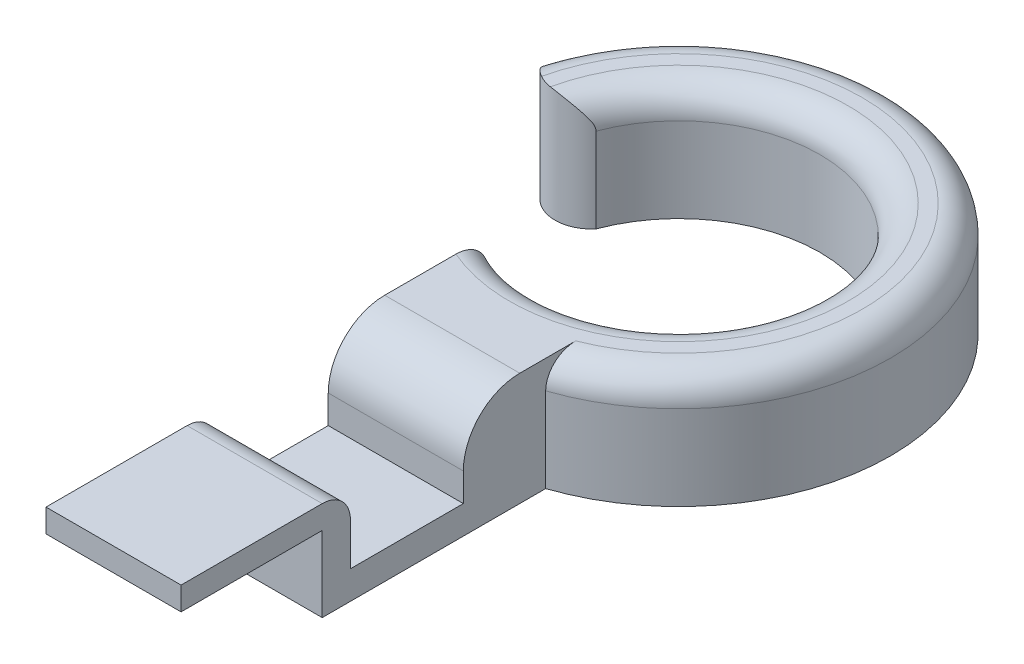
from build123d import *
from build123d.topology import SkipClean

# Parameters (mm, degrees)
BOSS_EXTRUDE1_DEPTH = 8
SKETCH2_W           = 9.571982136
SKETCH2_H           = 10
BOSS_EXTRUDE2_DEPTH = 2
BOSS_EXTRUDE3_DEPTH = 9.571982
FILLET1_R           = 2
FILLET2_R           = 4
FILLET3_R           = 2
SKETCH4_W           = 9.571982136
SKETCH4_H           = 1.647948381
BOSS_EXTRUDE4_DEPTH = 6


with BuildPart() as part:
    # Sketch1 → Boss-Extrude1 (new body)
    with BuildSketch(Plane(origin=(0, 0, 0), x_dir=(1, 0, 0), z_dir=(0, 1, 0))):
        with BuildLine():
            Line((-4.785991068, -8.780335386), (-4.785991068, -20.052065634))
            Line((-4.785991068, -20.052065634), (4.785991068, -20.052065634))
            Line((4.785991068, -20.052065634), (4.785991068, -14.215987109))
            ThreePointArc((4.785991068, -14.215987109), (10.931257236, 10.271689989), (-13.891030007, 5.660325552))
            ThreePointArc((-13.891030007, 5.660325552), (-12.461541016, 2.832721051), (-9.365408089, 3.505585733))
            ThreePointArc((-9.365408089, 3.505585733), (9.370244872, 3.492636688), (-4.785991068, -8.780335386))
        make_face()
    extrude(amount=BOSS_EXTRUDE1_DEPTH)

    # Sketch2 → Boss-Extrude2 (add)
    with BuildSketch(Plane.XZ):
        with Locations((0, 25.052065634)):
            Rectangle(SKETCH2_W, SKETCH2_H)
    extrude(amount=-BOSS_EXTRUDE2_DEPTH)

    # Sketch3 → Boss-Extrude3 (add)
    with SkipClean():  # the faces are left unmerged after this step: merging them gives an invalid solid
        with BuildSketch(Plane.ZY.offset(4.785991068)):
            Polygon((28.052065634, 2), (30.052065634, 2), (30.052065634, 5.352051619), (34.052065634, 5.352051619), (34.052065634, 7), (28.052065634, 7), align=None)
        extrude(amount=-BOSS_EXTRUDE3_DEPTH)

    # Fillet1
    fillet1_edges = [part.edges().sort_by_distance(p)[0] for p in [
        (-6.8e-08, 7, 28.052065634),
    ]]
    fillet(fillet1_edges, radius=FILLET1_R)

    # Fillet2
    fillet2_edges = [part.edges().sort_by_distance(p)[0] for p in [
        (0, 8, 20.052065634),
    ]]
    fillet(fillet2_edges, radius=FILLET2_R)

    # Fillet3
    fillet3_edges = [part.edges().sort_by_distance(p)[0] for p in [
        (9.370244872, 8, -3.492636688),
        (10.931257236, 8, -10.271689989),
    ]]
    fillet(fillet3_edges, radius=FILLET3_R)

    # Sketch4 → Boss-Extrude4 (add)
    with BuildSketch(Plane.XY.offset(34.052065634)):
        with Locations((0, 6.17602581)):
            Rectangle(SKETCH4_W, SKETCH4_H)
    extrude(amount=BOSS_EXTRUDE4_DEPTH)


solid = part.part
